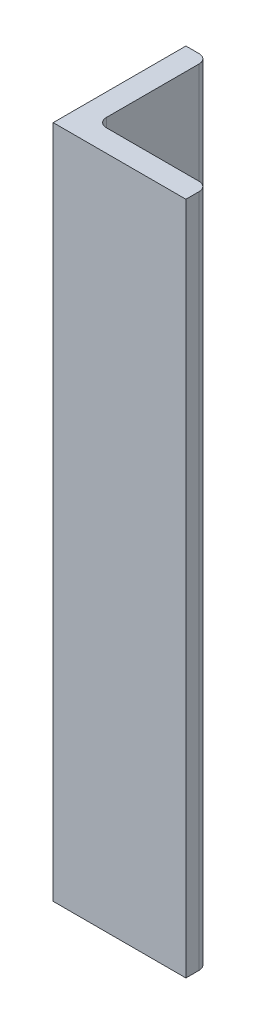
from build123d import *

# Parameters (mm, degrees)
BOSS_EXTRUDE1_DEPTH = 96.8248


with BuildPart() as part:
    # Sketch1 → Boss-Extrude1 (new body)
    with BuildSketch(Plane(origin=(0, 0, 0), x_dir=(1, 0, 0), z_dir=(0, 1, 0))):
        with BuildLine():
            Line((0, 0), (0, 19.05))
            Line((0, 19.05), (1.905, 19.05))
            ThreePointArc((1.905, 19.05), (2.803025612, 18.678025612), (3.175, 17.78))
            Line((3.175, 17.78), (3.175, 4.445))
            ThreePointArc((3.175, 4.445), (3.546974388, 3.546974388), (4.445, 3.175))
            Line((4.445, 3.175), (17.78, 3.175))
            ThreePointArc((17.78, 3.175), (18.678025612, 2.803025612), (19.05, 1.905))
            Line((19.05, 1.905), (19.05, 0))
            Line((19.05, 0), (0, 0))
        make_face()
    extrude(amount=BOSS_EXTRUDE1_DEPTH)


solid = part.part
